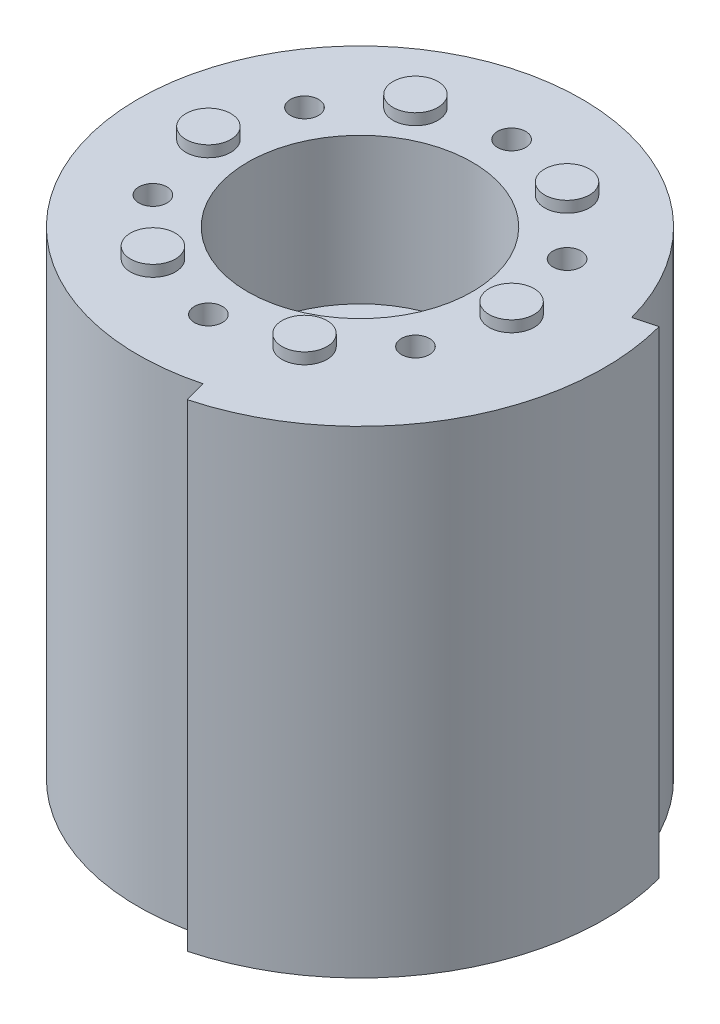
from build123d import *

# Parameters (mm, degrees)
SKETCH_1_R          = 19.75
SKETCH_1_R_2        = 18.75
EXTRUDE_1_DEPTH     = 1
SKETCH_2_R          = 19.75
EXTRUDE_2_DEPTH     = 41.8
SKETCH_3_R          = 10
SKETCH_3_R_2        = 1.25
CUT_EXTRUDE_1_DEPTH = 13
SKETCH_4_R          = 2
EXTRUDE_3_DEPTH     = 1
SKETCH_5_R          = 2
EXTRUDE_4_DEPTH     = 1
SKETCH_6_R          = 3
CUT_EXTRUDE_2_DEPTH = 6
EXTRUDE_START       = -42.8
EXTRUDE_5_DEPTH     = 42.8
SKETCH_9_R          = 25
CUT_EXTRUDE_4_DEPTH = 0.25


with BuildPart() as part:
    # 草图1 → 凸台-拉伸1 (new body)
    with BuildSketch(Plane(origin=(0, 0, 0), x_dir=(1, 0, 0), z_dir=(0, 1, 0))):
        with Locations(Location((0, 0, 0), (0, 0, 270))):
            Circle(SKETCH_1_R)
        with Locations(Location((0, 0, 0), (0, 0, 270))):
            Circle(SKETCH_1_R_2, mode=Mode.SUBTRACT)
    extrude(amount=EXTRUDE_1_DEPTH)

    # 草图2 → 凸台-拉伸2 (add)
    with BuildSketch(Plane(origin=(0, 1, 0), x_dir=(1, 0, 0), z_dir=(0, 1, 0))):
        with Locations(Location((0, 0, 0), (0, 0, 270))):
            Circle(SKETCH_2_R)
    extrude(amount=EXTRUDE_2_DEPTH)

    # 草图3 → 切除-拉伸1 (cut)
    with BuildSketch(Plane(origin=(0, 42.8, 0), x_dir=(1, 0, 0), z_dir=(0, 1, 0))):
        with Locations(Location((0, 0, 0), (0, 0, 270))):
            Circle(SKETCH_3_R)
        with Locations(Location((0, 13.5, 0), (0, 0, 270))):
            Circle(SKETCH_3_R_2)
        with Locations(Location((11.691342951, 6.75, 0), (0, 0, 270))):
            Circle(SKETCH_3_R_2)
        with Locations(Location((11.691342951, -6.75, 0), (0, 0, 270))):
            Circle(SKETCH_3_R_2)
        with Locations(Location((0, -13.5, 0), (0, 0, 270))):
            Circle(SKETCH_3_R_2)
        with Locations(Location((-11.691342951, -6.75, 0), (0, 0, 270))):
            Circle(SKETCH_3_R_2)
        with Locations(Location((-11.691342951, 6.75, 0), (0, 0, 270))):
            Circle(SKETCH_3_R_2)
    extrude(amount=-CUT_EXTRUDE_1_DEPTH, mode=Mode.SUBTRACT)

    # 草图4 → 凸台-拉伸3 (add)
    with BuildSketch(Plane.XZ.offset(-1)):
        with Locations(Location((12, 0, 0), (0, 0, 90))):
            Circle(SKETCH_4_R)
        with Locations(Location((-6, -10.392304845, 0), (0, 0, 90))):
            Circle(SKETCH_4_R)
        with Locations(Location((-6, 10.392304845, 0), (0, 0, 90))):
            Circle(SKETCH_4_R)
    extrude(amount=EXTRUDE_3_DEPTH)

    # 草图5 → 凸台-拉伸4 (add)
    with BuildSketch(Plane(origin=(0, 42.8, 0), x_dir=(1, 0, 0), z_dir=(0, 1, 0))):
        with Locations(Location((13.5, 0, 0), (0, 0, 270))):
            Circle(SKETCH_5_R)
        with Locations(Location((6.75, -11.691342951, 0), (0, 0, 270))):
            Circle(SKETCH_5_R)
        with Locations(Location((-6.75, -11.691342951, 0), (0, 0, 270))):
            Circle(SKETCH_5_R)
        with Locations(Location((-13.5, 0, 0), (0, 0, 270))):
            Circle(SKETCH_5_R)
        with Locations(Location((-6.75, 11.691342951, 0), (0, 0, 270))):
            Circle(SKETCH_5_R)
        with Locations(Location((6.75, 11.691342951, 0), (0, 0, 270))):
            Circle(SKETCH_5_R)
    extrude(amount=EXTRUDE_4_DEPTH)

    # 草图6 → 切除-拉伸2 (cut)
    with BuildSketch(Plane.XZ.offset(-1)):
        with Locations(Location((-13.5, 0, 0), (0, 0, 270))):
            Circle(SKETCH_6_R)
        with Locations(Location((6.75, 11.691342951, 0), (0, 0, 270))):
            Circle(SKETCH_6_R)
        with Locations(Location((6.75, -11.691342951, 0), (0, 0, 270))):
            Circle(SKETCH_6_R)
    extrude(amount=-CUT_EXTRUDE_2_DEPTH, mode=Mode.SUBTRACT)

    # 草图7 → 凸台-拉伸5 (add)
    with BuildSketch(Plane(origin=(0, 42.8, 0), x_dir=(1, 0, 0), z_dir=(0, 1, 0)).offset(EXTRUDE_START)):
        with BuildLine():
            ThreePointArc((21.75, 0), (21.563925735, 2.838944681), (21.008886722, 5.629314231))
            Line((21.008886722, 5.629314231), (19.077035069, 5.111676141))
            ThreePointArc((19.077035069, 5.111676141), (19.581036012, 2.577892296), (19.75, 0))
            ThreePointArc((19.75, 0), (15.668728471, -12.023038223), (5.111676141, -19.077035069))
            Line((5.111676141, -19.077035069), (5.629314231, -21.008886722))
            ThreePointArc((5.629314231, -21.008886722), (17.255435151, -13.240561081), (21.75, 0))
        make_face()
    extrude(amount=EXTRUDE_5_DEPTH)

    # 草图9 → 切除-拉伸4 (cut)
    with BuildSketch(Plane.XZ):
        Circle(SKETCH_9_R)
    extrude(amount=-CUT_EXTRUDE_4_DEPTH, mode=Mode.SUBTRACT)


solid = part.part
